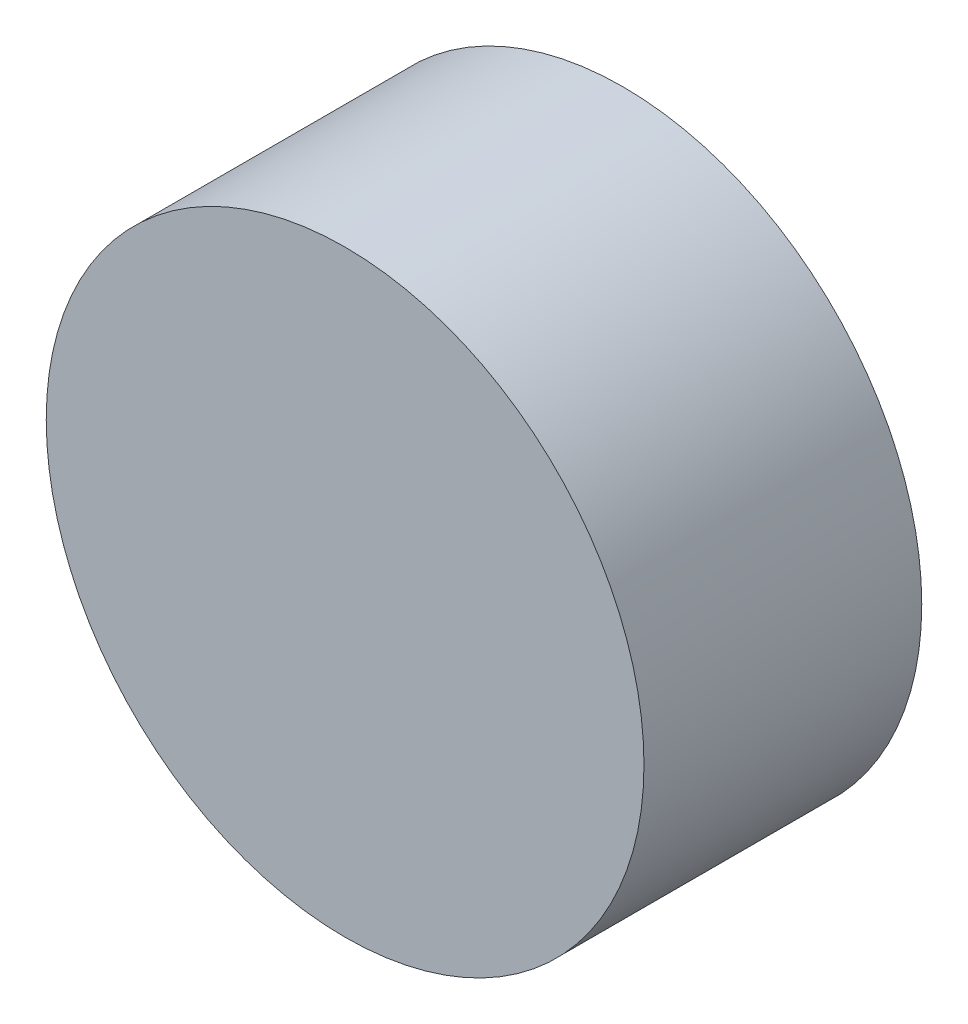
from build123d import *

# Parameters (mm, degrees)
SKETCH2_R           = 43.18
BOSS_EXTRUDE1_DEPTH = 40.132


with BuildPart() as part:
    # Sketch2 → Boss-Extrude1 (new body)
    with BuildSketch(Plane.XY):
        Circle(SKETCH2_R)
    extrude(amount=BOSS_EXTRUDE1_DEPTH)


solid = part.part
